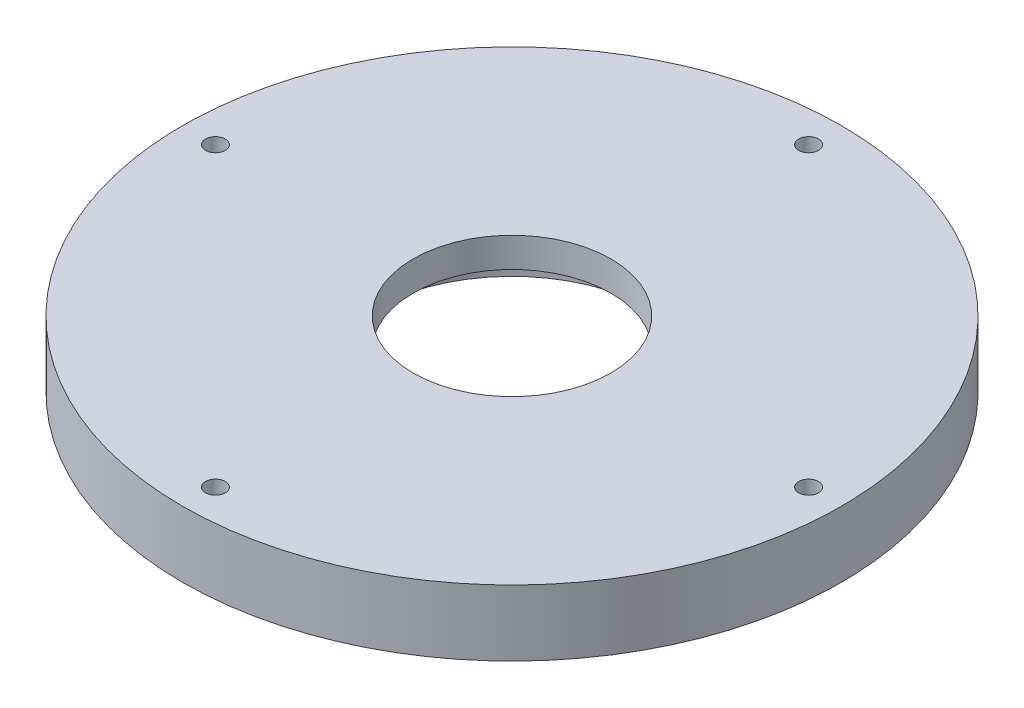
from build123d import *

# Parameters (mm, degrees)
SKETCH_2_R          = 100
SKETCH_2_R_2        = 3
SKETCH_2_R_3        = 30
EXTRUDE_1_DEPTH     = 20
SKETCH_3_R          = 43
CUT_EXTRUDE_1_DEPTH = 11


with BuildPart() as part:
    # 草图2 → 凸台-拉伸1 (new body)
    with BuildSketch(Plane(origin=(0, 0, 0), x_dir=(1, 0, 0), z_dir=(0, 1, 0))):
        with Locations(Location((0, 0, 0), (0, 0, 270))):
            Circle(SKETCH_2_R)
        with Locations(Location((0, 90, 0), (0, 0, 270))):
            Circle(SKETCH_2_R_2, mode=Mode.SUBTRACT)
        with Locations(Location((90, 0, 0), (0, 0, 270))):
            Circle(SKETCH_2_R_2, mode=Mode.SUBTRACT)
        with Locations(Location((0, -90, 0), (0, 0, 270))):
            Circle(SKETCH_2_R_2, mode=Mode.SUBTRACT)
        with Locations(Location((-90, 0, 0), (0, 0, 270))):
            Circle(SKETCH_2_R_2, mode=Mode.SUBTRACT)
        with Locations(Location((0, 0, 0), (0, 0, 270))):
            Circle(SKETCH_2_R_3, mode=Mode.SUBTRACT)
    extrude(amount=EXTRUDE_1_DEPTH)

    # 草图3 → 切除-拉伸1 (cut)
    with BuildSketch(Plane.XZ):
        with Locations(Location((0, 0, 0), (0, 0, 270))):
            Circle(SKETCH_3_R)
    extrude(amount=-CUT_EXTRUDE_1_DEPTH, mode=Mode.SUBTRACT)


solid = part.part
